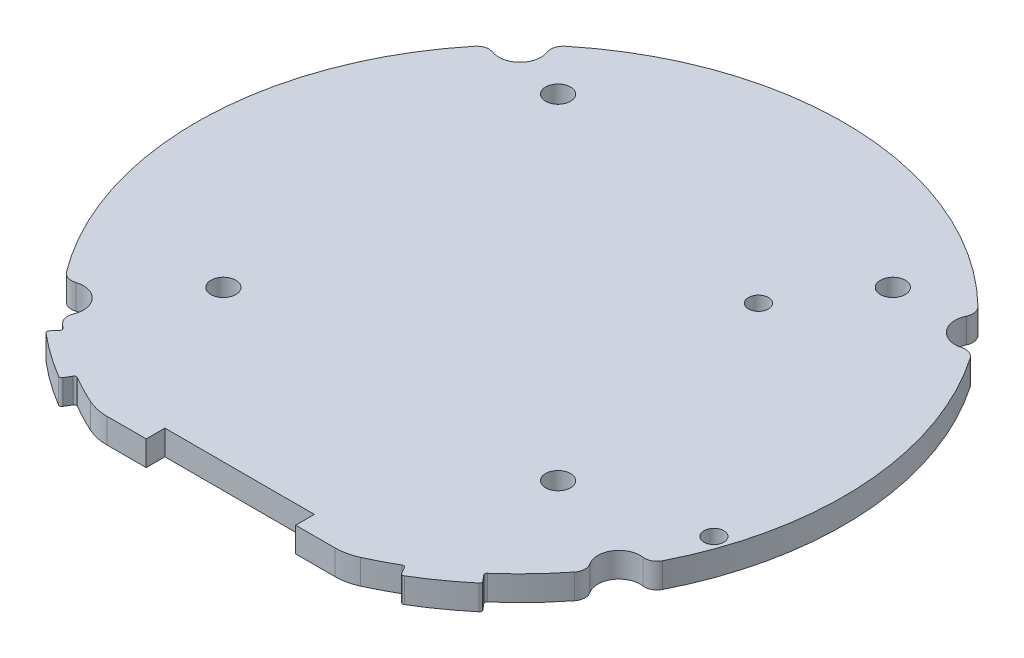
from build123d import *

# Parameters (mm, degrees)
SKETCH1_R               = 13
BOSS_EXTRUDE1_DEPTH     = 1
CUT_EXTRUDE2_DEPTH      = 1
FILLET1_R               = 2
SKETCH4_R               = 0.5
CUT_EXTRUDE3_DEPTH      = 1
SKETCH6_R               = 0.85
CUT_EXTRUDE4_DEPTH      = 10
FILLET2_R               = 0.5
BOSS_EXTRUDE4_START     = -1
BOSS_EXTRUDE4_DEPTH     = 1
FILLET4_R               = 0.1
CUT_EXTRUDE6_DEPTH      = 19.411952786
CUT_EXTRUDE6_DEPTH_BACK = 19.411952786
SKETCH11_W              = 6
SKETCH11_H              = 1.5
SKETCH12_R              = 0.4
CUT_EXTRUDE7_DEPTH      = 1


with BuildPart() as part:
    # Sketch1 → Boss-Extrude1 (new body)
    with BuildSketch(Plane(origin=(0, 0, 0), x_dir=(1, 0, 0), z_dir=(0, 1, 0))):
        with Locations(Location((0, 0, 0), (0, 0, 270))):
            Circle(SKETCH1_R)
    extrude(amount=BOSS_EXTRUDE1_DEPTH)

    # Sketch3 → Cut-Extrude2 (cut)
    with BuildSketch(Plane(origin=(0, 0, 0), x_dir=(1, 0, 0), z_dir=(0, 1, 0))):
        with BuildLine():
            Line((-5, -12), (5, -12))
            ThreePointArc((5, -12), (0, -13), (-5, -12))
        make_face()
    extrude(amount=CUT_EXTRUDE2_DEPTH, mode=Mode.SUBTRACT)

    # Fillet1
    fillet1_edges = [part.edges().sort_by_distance(p)[0] for p in [
        (-5, 0.5, 12),
        (5, 0.5, 12),
    ]]
    fillet(fillet1_edges, radius=FILLET1_R)

    # Sketch4 → Cut-Extrude3 (cut)
    with BuildSketch(Plane.XZ):
        with Locations(Location((6.717514421, 5.186869411, 0), (0, 0, 270))):
            Circle(SKETCH4_R)
        with Locations(Location((-6.717514421, 5.186869411, 0), (0, 0, 270))):
            Circle(SKETCH4_R)
        with Locations(Location((-6.717514421, -8.248159431, 0), (0, 0, 270))):
            Circle(SKETCH4_R)
        with Locations(Location((6.717514421, -8.248159431, 0), (0, 0, 270))):
            Circle(SKETCH4_R)
    extrude(amount=-CUT_EXTRUDE3_DEPTH, mode=Mode.SUBTRACT)

    # Sketch6 → Cut-Extrude4 (cut)
    with BuildSketch(Plane.XZ):
        with Locations((9.958577761, -8.356238926)):
            Circle(SKETCH6_R)
        with Locations((-9.584605379, 8.782672699)):
            Circle(SKETCH6_R)
        with Locations((-9.192388155, -9.192388155)):
            Circle(SKETCH6_R)
        with Locations((10.964088796, 6.984894909)):
            Circle(SKETCH6_R)
    extrude(amount=-CUT_EXTRUDE4_DEPTH, mode=Mode.SUBTRACT)

    # Fillet2
    fillet2_edges = [part.edges().sort_by_distance(p)[0] for p in [
        (10.484191703, 0.5, 7.686463708),
        (11.397112787, 0.5, 6.25346465),
        (-10.138062294, 0.5, 8.137548337),
        (-8.990172858, 0.5, 9.390249836),
        (-8.57201926, 0.5, -9.773458232),
        (-9.773458232, 0.5, -8.57201926),
        (10.483367978, 0.5, -7.687587127),
        (9.39121315, 0.5, -8.989166567),
    ]]
    fillet(fillet2_edges, radius=FILLET2_R)

    # Sketch10 → Boss-Extrude4 (add)
    with BuildSketch(Plane(origin=(0, 1, 0), x_dir=(1, 0, 0), z_dir=(0, 1, 0)).offset(BOSS_EXTRUDE4_START)):
        with BuildLine():
            Line((-6.597998718, -11.201179086), (-6.8517679, -11.631993666))
            ThreePointArc((-6.8517679, -11.631993666), (-7.839489902, -10.990559498), (-8.767548652, -10.265480536))
            Line((-8.767548652, -10.265480536), (-8.442824628, -9.885277553))
            ThreePointArc((-8.442824628, -9.885277553), (-7.549138424, -10.583501739), (-6.597998718, -11.201179086))
        make_face()
        with BuildLine():
            Line((8.442824628, -9.885277553), (8.767548652, -10.265480536))
            ThreePointArc((8.767548652, -10.265480536), (7.839489902, -10.990559498), (6.8517679, -11.631993666))
            Line((6.8517679, -11.631993666), (6.597998718, -11.201179086))
            ThreePointArc((6.597998718, -11.201179086), (7.549138424, -10.583501739), (8.442824628, -9.885277553))
        make_face()
    extrude(amount=BOSS_EXTRUDE4_DEPTH)

    # Fillet4
    fillet4_edges = [part.edges().sort_by_distance(p)[0] for p in [
        (-8.442824628, 0.5, 9.885277553),
        (-6.597998718, 0.5, 11.201179086),
        (-6.8517679, 0.5, 11.631993666),
        (-8.767548652, 0.5, 10.265480536),
        (6.597998718, 0.5, 11.201179086),
        (8.442824628, 0.5, 9.885277553),
        (8.767548652, 0.5, 10.265480536),
        (6.8517679, 0.5, 11.631993666),
    ]]
    fillet(fillet4_edges, radius=FILLET4_R)

    # Sketch11 → Cut-Extrude6 (cut, two sides: drawn at the far end of the back side and taken through both)
    with BuildSketch(Plane(origin=(0, 0, 0), x_dir=(1, 0, 0), z_dir=(0, 1, 0)).offset(-CUT_EXTRUDE6_DEPTH_BACK)):
        with Locations((0, -12)):
            Rectangle(SKETCH11_W, SKETCH11_H)
    extrude(amount=CUT_EXTRUDE6_DEPTH + CUT_EXTRUDE6_DEPTH_BACK, mode=Mode.SUBTRACT)

    # Sketch12 → Cut-Extrude7 (cut)
    with BuildSketch(Plane(origin=(0, 1, 0), x_dir=(1, 0, 0), z_dir=(0, 1, 0))):
        with Locations(Location((4.571073678, 5, 0), (0, 0, 270))):
            Circle(SKETCH12_R)
        with Locations(Location((11.782754706, -4.000000001, 0), (0, 0, 270))):
            Circle(SKETCH12_R)
    extrude(amount=-CUT_EXTRUDE7_DEPTH, mode=Mode.SUBTRACT)


solid = part.part
